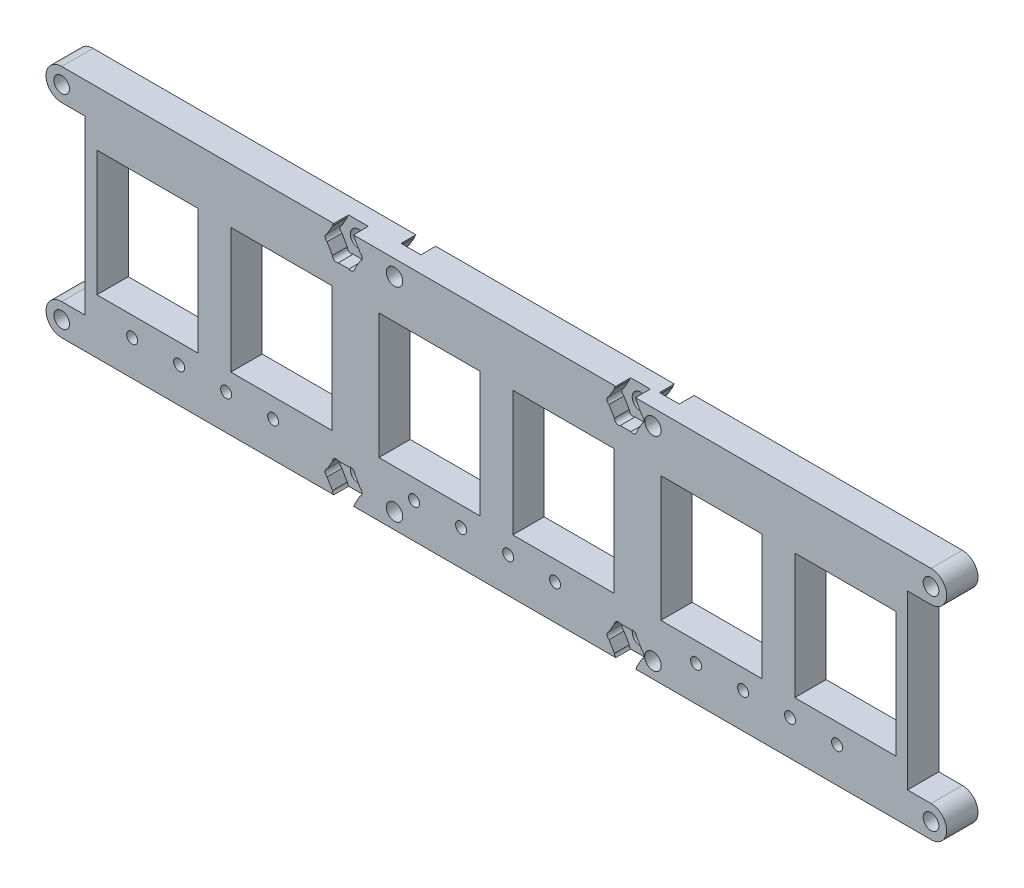
from build123d import *

# Parameters (mm, degrees)
SKETCH1_R           = 0.7
SKETCH1_R_2         = 1.05
SKETCH1_R_3         = 1
SKETCH1_W           = 12.9
SKETCH1_H           = 16
BOSS_EXTRUDE1_DEPTH = 4
SKETCH3_R           = 1.05
CUT_EXTRUDE2_DEPTH  = 10
SKETCH3_3_R         = 1.05
CUT_EXTRUDE3_DEPTH  = 1.9
SKETCH5_R           = 1
CUT_EXTRUDE4_DEPTH  = 1.9


with BuildPart() as part:
    # Sketch1 → Boss-Extrude1 (new body)
    with BuildSketch(Plane.XY):
        with BuildLine():
            Line((-52.239956917, 15), (52.760043083, 15))
            Line((52.760043083, 15), (55.760043083, 15))
            ThreePointArc((55.760043083, 15), (57.760043083, 13), (55.760043083, 11))
            Line((55.760043083, 11), (52.760043083, 11))
            Line((52.760043083, 11), (52.760043083, -11.002))
            Line((52.760043083, -11.002), (55.760043083, -11.002))
            ThreePointArc((55.760043083, -11.002), (57.759043083, -13.001), (55.760043083, -15))
            Line((55.760043083, -15), (52.760043083, -15))
            Line((52.760043083, -15), (-52.239956917, -15))
            Line((-52.239956917, -15), (-55.239956917, -15))
            ThreePointArc((-55.239956917, -15), (-57.238956917, -13.001), (-55.239956917, -11.002))
            Line((-55.239956917, -11.002), (-52.239956917, -11.002))
            Line((-52.239956917, -11.002), (-52.239956917, 11))
            Line((-52.239956917, 11), (-55.239956917, 11))
            ThreePointArc((-55.239956917, 11), (-56.654170479, 11.585786438), (-57.239956917, 13))
            ThreePointArc((-57.239956917, 13), (-56.654170479, 14.414213562), (-55.239956917, 15))
            Line((-55.239956917, 15), (-52.239956917, 15))
        make_face()
        with Locations((-46.239956917, -10.5)):
            Circle(SKETCH1_R, mode=Mode.SUBTRACT)
        with Locations((-40.239956917, -10.5)):
            Circle(SKETCH1_R, mode=Mode.SUBTRACT)
        with Locations((-34.239956917, -10.5)):
            Circle(SKETCH1_R, mode=Mode.SUBTRACT)
        with Locations((-28.239956917, -10.5)):
            Circle(SKETCH1_R, mode=Mode.SUBTRACT)
        with Locations((-10.239956917, -10.5)):
            Circle(SKETCH1_R, mode=Mode.SUBTRACT)
        with Locations((-4.239956917, -10.5)):
            Circle(SKETCH1_R, mode=Mode.SUBTRACT)
        with Locations((1.760043083, -10.5)):
            Circle(SKETCH1_R, mode=Mode.SUBTRACT)
        with Locations((7.760043083, -10.5)):
            Circle(SKETCH1_R, mode=Mode.SUBTRACT)
        with Locations((25.760043083, -10.5)):
            Circle(SKETCH1_R, mode=Mode.SUBTRACT)
        with Locations((31.760043083, -10.5)):
            Circle(SKETCH1_R, mode=Mode.SUBTRACT)
        with Locations((37.760043083, -10.5)):
            Circle(SKETCH1_R, mode=Mode.SUBTRACT)
        with Locations((43.760043083, -10.5)):
            Circle(SKETCH1_R, mode=Mode.SUBTRACT)
        with Locations((-19.239956917, 13)):
            Circle(SKETCH1_R_2, mode=Mode.SUBTRACT)
        with Locations((16.760043083, 13)):
            Circle(SKETCH1_R_2, mode=Mode.SUBTRACT)
        with Locations((-19.239956917, -13.001)):
            Circle(SKETCH1_R_2, mode=Mode.SUBTRACT)
        with Locations((16.760043083, -13.001)):
            Circle(SKETCH1_R_2, mode=Mode.SUBTRACT)
        with Locations((-55.239956917, 13)):
            Circle(SKETCH1_R_3, mode=Mode.SUBTRACT)
        with Locations((-55.239956917, -13.001)):
            Circle(SKETCH1_R_3, mode=Mode.SUBTRACT)
        with Locations((55.760043083, 13)):
            Circle(SKETCH1_R_3, mode=Mode.SUBTRACT)
        with Locations((55.760043083, -13.001)):
            Circle(SKETCH1_R_3, mode=Mode.SUBTRACT)
        with Locations((-44.286738712, 0.001996245)):
            Rectangle(SKETCH1_W, SKETCH1_H, mode=Mode.SUBTRACT)
        with Locations((-27.186738712, 0.001996245)):
            Rectangle(SKETCH1_W, SKETCH1_H, mode=Mode.SUBTRACT)
        with Locations((-8.286738712, 0.001996245)):
            Rectangle(SKETCH1_W, SKETCH1_H, mode=Mode.SUBTRACT)
        with Locations((8.813261288, 0.001996245)):
            Rectangle(SKETCH1_W, SKETCH1_H, mode=Mode.SUBTRACT)
        with Locations((27.713261288, 0.001996245)):
            Rectangle(SKETCH1_W, SKETCH1_H, mode=Mode.SUBTRACT)
        with Locations((44.813261288, 0.001996245)):
            Rectangle(SKETCH1_W, SKETCH1_H, mode=Mode.SUBTRACT)
    extrude(amount=BOSS_EXTRUDE1_DEPTH)

    # Sketch3 → Cut-Extrude2 (cut)
    with BuildSketch(Plane.XY):
        with Locations(Location((20.260043083, -13, 0), (0, 0, 180))):
            Circle(SKETCH3_R)
        with Locations(Location((-12.739956917, -13, 0), (0, 0, 180))):
            Circle(SKETCH3_R)
        with Locations(Location((-12.739956917, 13, 0), (0, 0, 180))):
            Circle(SKETCH3_R)
        with Locations(Location((20.260043083, 13, 0), (0, 0, 180))):
            Circle(SKETCH3_R)
    extrude(amount=CUT_EXTRUDE2_DEPTH, mode=Mode.SUBTRACT)

    # Sketch3<3> → Cut-Extrude3 (cut)
    # profile 1 of 4: a face of its own
    with BuildSketch(Plane.XY):
        with BuildLine():
            Line((-13.990057076, -15), (-11.494817407, -15))
            ThreePointArc((-11.494817407, -15), (-11.357427326, -14.826438351), (-11.30843397, -14.610569569))
            Line((-11.30843397, -14.610569569), (-10.627270358, -13.427159699))
            ThreePointArc((-10.627270358, -13.427159699), (-10.377272188, -12.99550025), (-10.624930126, -12.562493886))
            Line((-10.624930126, -12.562493886), (-11.309707084, -11.376425403))
            ThreePointArc((-11.309707084, -11.376425403), (-11.558778487, -10.943938405), (-12.057856643, -10.942337857))
            Line((-12.057856643, -10.942337857), (-13.426426529, -10.94504634))
            ThreePointArc((-13.426426529, -10.94504634), (-13.927204937, -10.943698167), (-14.17798086, -11.377163584))
            Line((-14.17798086, -11.377163584), (-14.855939357, -12.555005093))
            ThreePointArc((-14.855939357, -12.555005093), (-15.113624097, -12.990196273), (-14.859728082, -13.427608667))
            Line((-14.859728082, -13.427608667), (-14.175052209, -14.613502065))
            ThreePointArc((-14.175052209, -14.613502065), (-14.126055178, -14.827572327), (-13.990057076, -15))
        make_face()
        with Locations(Location((-12.739956917, -13, 0), (0, 0, 180))):
            Circle(SKETCH3_3_R, mode=Mode.SUBTRACT)
    # profile 2 of 4: a face of its own
    with BuildSketch(Plane.XY):
        with BuildLine():
            Line((19.009942924, -15), (21.505182593, -15))
            ThreePointArc((21.505182593, -15), (21.642572674, -14.826438351), (21.69156603, -14.610569569))
            Line((21.69156603, -14.610569569), (22.372729642, -13.427159699))
            ThreePointArc((22.372729642, -13.427159699), (22.622727812, -12.99550025), (22.375069874, -12.562493886))
            Line((22.375069874, -12.562493886), (21.690292916, -11.376425403))
            ThreePointArc((21.690292916, -11.376425403), (21.441221513, -10.943938405), (20.942143357, -10.942337857))
            Line((20.942143357, -10.942337857), (19.573573471, -10.94504634))
            ThreePointArc((19.573573471, -10.94504634), (19.072795063, -10.943698167), (18.82201914, -11.377163584))
            Line((18.82201914, -11.377163584), (18.144060643, -12.555005093))
            ThreePointArc((18.144060643, -12.555005093), (17.886375903, -12.990196273), (18.140271918, -13.427608667))
            Line((18.140271918, -13.427608667), (18.824947791, -14.613502065))
            ThreePointArc((18.824947791, -14.613502065), (18.873944822, -14.827572327), (19.009942924, -15))
        make_face()
        with Locations(Location((20.260043083, -13, 0), (0, 0, 180))):
            Circle(SKETCH3_3_R, mode=Mode.SUBTRACT)
    # profile 3 of 4: a face of its own
    with BuildSketch(Plane.XY):
        with BuildLine():
            ThreePointArc((21.690292916, 14.623574597), (21.645572471, 14.830275795), (21.51940196, 15))
            Line((21.51940196, 15), (18.993763291, 15))
            ThreePointArc((18.993763291, 15), (18.866975153, 14.830049631), (18.82201914, 14.622836416))
            Line((18.82201914, 14.622836416), (18.144060643, 13.444994907))
            ThreePointArc((18.144060643, 13.444994907), (17.886375903, 13.009803727), (18.140271918, 12.572391333))
            Line((18.140271918, 12.572391333), (18.824947791, 11.386497935))
            ThreePointArc((18.824947791, 11.386497935), (19.075431778, 10.955002608), (19.574361074, 10.954947189))
            Line((19.574361074, 10.954947189), (20.939420816, 10.957648726))
            ThreePointArc((20.939420816, 10.957648726), (21.440497464, 10.955787899), (21.69156603, 11.389430431))
            Line((21.69156603, 11.389430431), (22.372729642, 12.572840301))
            ThreePointArc((22.372729642, 12.572840301), (22.622727812, 13.00449975), (22.375069874, 13.437506114))
            Line((22.375069874, 13.437506114), (21.690292916, 14.623574597))
        make_face()
        with Locations(Location((20.260043083, 13, 0), (0, 0, 180))):
            Circle(SKETCH3_3_R, mode=Mode.SUBTRACT)
    # profile 4 of 4: a face of its own
    with BuildSketch(Plane.XY):
        with BuildLine():
            ThreePointArc((-11.309707084, 14.623574597), (-11.354427529, 14.830275795), (-11.48059804, 15))
            Line((-11.48059804, 15), (-14.006236709, 15))
            ThreePointArc((-14.006236709, 15), (-14.133024847, 14.830049631), (-14.17798086, 14.622836416))
            Line((-14.17798086, 14.622836416), (-14.855939357, 13.444994907))
            ThreePointArc((-14.855939357, 13.444994907), (-15.113624097, 13.009803727), (-14.859728082, 12.572391333))
            Line((-14.859728082, 12.572391333), (-14.175052209, 11.386497935))
            ThreePointArc((-14.175052209, 11.386497935), (-13.924568222, 10.955002608), (-13.425638926, 10.954947189))
            Line((-13.425638926, 10.954947189), (-12.060579184, 10.957648726))
            ThreePointArc((-12.060579184, 10.957648726), (-11.559502536, 10.955787899), (-11.30843397, 11.389430431))
            Line((-11.30843397, 11.389430431), (-10.627270358, 12.572840301))
            ThreePointArc((-10.627270358, 12.572840301), (-10.377272188, 13.00449975), (-10.624930126, 13.437506114))
            Line((-10.624930126, 13.437506114), (-11.309707084, 14.623574597))
        make_face()
        with Locations(Location((-12.739956917, 13, 0), (0, 0, 180))):
            Circle(SKETCH3_3_R, mode=Mode.SUBTRACT)
    extrude(amount=CUT_EXTRUDE3_DEPTH, mode=Mode.SUBTRACT)

    # Sketch5 → Cut-Extrude4 (cut)
    # profile 1 of 4: a face of its own
    with BuildSketch(Plane.XY.offset(4)):
        with BuildLine():
            Line((-19.920246102, 10.948325269), (-18.55518636, 10.951026806))
            ThreePointArc((-18.55518636, 10.951026806), (-18.054109712, 10.949165979), (-17.803041146, 11.382808511))
            Line((-17.803041146, 11.382808511), (-17.121877534, 12.566218381))
            ThreePointArc((-17.121877534, 12.566218381), (-16.871879364, 12.99787783), (-17.119537302, 13.430884194))
            Line((-17.119537302, 13.430884194), (-17.80431426, 14.616952677))
            ThreePointArc((-17.80431426, 14.616952677), (-18.053385663, 15.049439675), (-18.552463819, 15.051040223))
            Line((-18.552463819, 15.051040223), (-19.921033705, 15.04833174))
            ThreePointArc((-19.921033705, 15.04833174), (-20.421812113, 15.049679913), (-20.672588036, 14.616214496))
            Line((-20.672588036, 14.616214496), (-21.350546533, 13.438372987))
            ThreePointArc((-21.350546533, 13.438372987), (-21.608231273, 13.003181807), (-21.354335257, 12.565769413))
            Line((-21.354335257, 12.565769413), (-20.669659385, 11.379876015))
            ThreePointArc((-20.669659385, 11.379876015), (-20.419175398, 10.948380688), (-19.920246102, 10.948325269))
        make_face()
        with Locations((-19.240056759, 12.999319375)):
            Circle(SKETCH5_R, mode=Mode.SUBTRACT)
    # profile 2 of 4: a face of its own
    with BuildSketch(Plane.XY.offset(4)):
        with BuildLine():
            Line((16.079753898, 10.948325269), (17.44481364, 10.951026806))
            ThreePointArc((17.44481364, 10.951026806), (17.945890288, 10.949165979), (18.196958854, 11.382808511))
            Line((18.196958854, 11.382808511), (18.878122466, 12.566218381))
            ThreePointArc((18.878122466, 12.566218381), (19.128120636, 12.99787783), (18.880462698, 13.430884194))
            Line((18.880462698, 13.430884194), (18.19568574, 14.616952677))
            ThreePointArc((18.19568574, 14.616952677), (17.946614337, 15.049439675), (17.447536181, 15.051040223))
            Line((17.447536181, 15.051040223), (16.078966295, 15.04833174))
            ThreePointArc((16.078966295, 15.04833174), (15.578187887, 15.049679913), (15.327411964, 14.616214496))
            Line((15.327411964, 14.616214496), (14.649453467, 13.438372987))
            ThreePointArc((14.649453467, 13.438372987), (14.391768727, 13.003181807), (14.645664743, 12.565769413))
            Line((14.645664743, 12.565769413), (15.330340615, 11.379876015))
            ThreePointArc((15.330340615, 11.379876015), (15.580824602, 10.948380688), (16.079753898, 10.948325269))
        make_face()
        with Locations((16.759943241, 12.999319375)):
            Circle(SKETCH5_R, mode=Mode.SUBTRACT)
    # profile 3 of 4: a face of its own
    with BuildSketch(Plane.XY.offset(4)):
        with BuildLine():
            Line((16.079753898, -15.051674731), (17.44481364, -15.048973194))
            ThreePointArc((17.44481364, -15.048973194), (17.945890288, -15.050834021), (18.196958854, -14.617191489))
            Line((18.196958854, -14.617191489), (18.878122466, -13.433781619))
            ThreePointArc((18.878122466, -13.433781619), (19.128120636, -13.00212217), (18.880462698, -12.569115806))
            Line((18.880462698, -12.569115806), (18.19568574, -11.383047323))
            ThreePointArc((18.19568574, -11.383047323), (17.946614337, -10.950560325), (17.447536181, -10.948959777))
            Line((17.447536181, -10.948959777), (16.078966295, -10.95166826))
            ThreePointArc((16.078966295, -10.95166826), (15.578187887, -10.950320087), (15.327411964, -11.383785504))
            Line((15.327411964, -11.383785504), (14.649453467, -12.561627013))
            ThreePointArc((14.649453467, -12.561627013), (14.391768727, -12.996818193), (14.645664743, -13.434230587))
            Line((14.645664743, -13.434230587), (15.330340615, -14.620123985))
            ThreePointArc((15.330340615, -14.620123985), (15.580824602, -15.051619312), (16.079753898, -15.051674731))
        make_face()
        with Locations((16.759943241, -13.000680625)):
            Circle(SKETCH5_R, mode=Mode.SUBTRACT)
    # profile 4 of 4: a face of its own
    with BuildSketch(Plane.XY.offset(4)):
        with BuildLine():
            Line((-19.920246102, -15.051674731), (-18.55518636, -15.048973194))
            ThreePointArc((-18.55518636, -15.048973194), (-18.054109712, -15.050834021), (-17.803041146, -14.617191489))
            Line((-17.803041146, -14.617191489), (-17.121877534, -13.433781619))
            ThreePointArc((-17.121877534, -13.433781619), (-16.871879364, -13.00212217), (-17.119537302, -12.569115806))
            Line((-17.119537302, -12.569115806), (-17.80431426, -11.383047323))
            ThreePointArc((-17.80431426, -11.383047323), (-18.053385663, -10.950560325), (-18.552463819, -10.948959777))
            Line((-18.552463819, -10.948959777), (-19.921033705, -10.95166826))
            ThreePointArc((-19.921033705, -10.95166826), (-20.421812113, -10.950320087), (-20.672588036, -11.383785504))
            Line((-20.672588036, -11.383785504), (-21.350546533, -12.561627013))
            ThreePointArc((-21.350546533, -12.561627013), (-21.608231273, -12.996818193), (-21.354335257, -13.434230587))
            Line((-21.354335257, -13.434230587), (-20.669659385, -14.620123985))
            ThreePointArc((-20.669659385, -14.620123985), (-20.419175398, -15.051619312), (-19.920246102, -15.051674731))
        make_face()
        with Locations((-19.240056759, -13.000680625)):
            Circle(SKETCH5_R, mode=Mode.SUBTRACT)
    extrude(amount=-CUT_EXTRUDE4_DEPTH, mode=Mode.SUBTRACT)


solid = part.part
